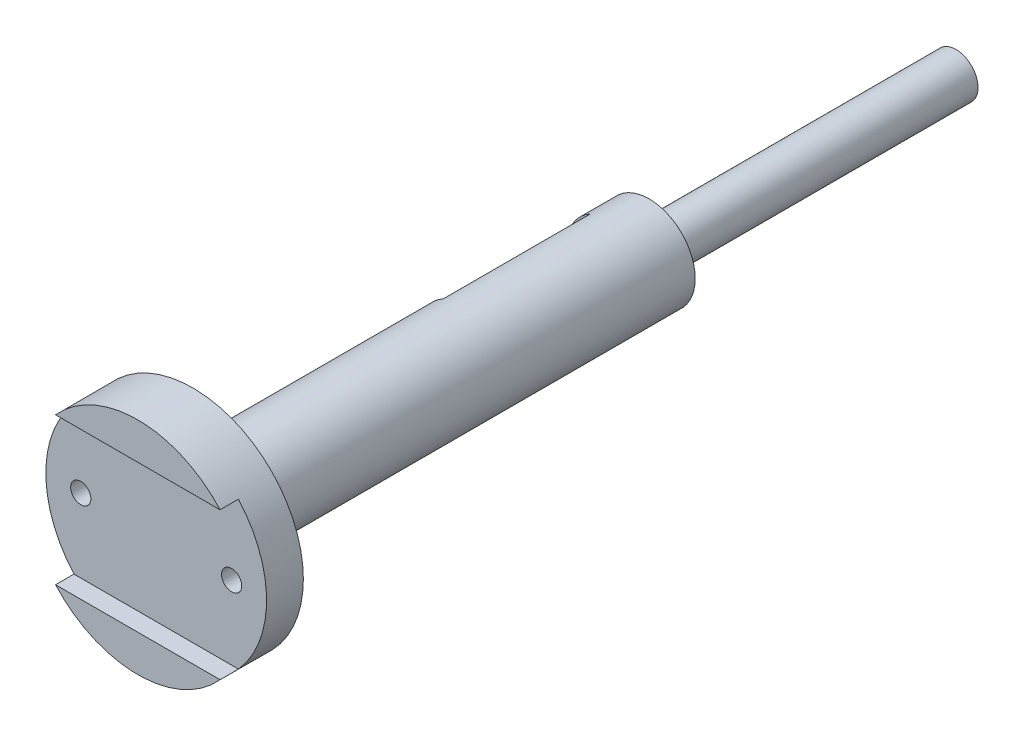
from build123d import *

# Parameters (mm, degrees)
ESQUISSE1_R                                = 30
BOSS_EXTRU_1_DEPTH                         = 15
ESQUISSE2_R                                = 12.5
BOSS_EXTRU_2_DEPTH                         = 124
ESQUISSE4_2_W                              = 230
ESQUISSE4_2_H                              = 40
ENL_V_MAT_EXTRU_1_DEPTH                    = 5
CHAMBRAGE_POUR_VIS_T_TE_HEXAGONALE_2_COUNT = 2
CHAMBRAGE_POUR_VIS_T_TE_HEXAGONALE_2_PITCH = 41
ESQUISSE17_R                               = 6
BOSS_EXTRU_4_DEPTH                         = 83.38
ESQUISSE18_W                               = 10.356322474
ESQUISSE18_H                               = 3
ENL_V_MAT_EXTRU_2_DEPTH                    = 3
ESQUISSE19_W                               = 7.933443835
ESQUISSE19_H                               = 21.9317122
ENL_V_MAT_EXTRU_3_DEPTH                    = 50
BOSS_EXTRU_6_START                         = -10
ESQUISSE21_R                               = 12.5
BOSS_EXTRU_6_DEPTH                         = 10


with BuildPart() as part:
    # Esquisse1 → Boss.-Extru.1 (new body)
    with BuildSketch(Plane.XY):
        Circle(ESQUISSE1_R)
    extrude(amount=BOSS_EXTRU_1_DEPTH)

    # Esquisse2 → Boss.-Extru.2 (add)
    with BuildSketch(Plane(origin=(0, 0, 0), x_dir=(-1, 0, 0), z_dir=(0, 0, -1))):
        Circle(ESQUISSE2_R)
    extrude(amount=BOSS_EXTRU_2_DEPTH)

    # Esquisse4<2> → Enlèv. mat.-Extru.1 (cut)
    with BuildSketch(Plane.XY.offset(15)):
        Rectangle(ESQUISSE4_2_W, ESQUISSE4_2_H)
    extrude(amount=-ENL_V_MAT_EXTRU_1_DEPTH, mode=Mode.SUBTRACT)

    # Esquisse14 → Chambrage pour vis à tête hexagonale M51 (revolve, cut)
    with BuildSketch(Plane.YZ.offset(-20.5)):
        Polygon((0, 0), (0, 15), (2.75, 15), (2.75, 3.605), (2.775, 3.58), (6.12, 3.58), (6.12, 0), align=None)
    chambrage_pour_vis_t_te_hexagonale_m51 = revolve(axis=Axis((-20.5, 0, -6.35), (0, 0, 1)), mode=Mode.SUBTRACT)

    # Chambrage pour vis _ t_te hexagonale 2: Chambrage pour vis à tête hexagonale M51 ×2
    with Locations(*[(i * CHAMBRAGE_POUR_VIS_T_TE_HEXAGONALE_2_PITCH, 0, 0) for i in range(1, CHAMBRAGE_POUR_VIS_T_TE_HEXAGONALE_2_COUNT)]):
        add(chambrage_pour_vis_t_te_hexagonale_m51, mode=Mode.SUBTRACT)

    # Esquisse17 → Boss.-Extru.4 (add)
    with BuildSketch(Plane(origin=(0, 0, -124), x_dir=(-1, 0, 0), z_dir=(0, 0, -1))):
        Circle(ESQUISSE17_R)
    extrude(amount=BOSS_EXTRU_4_DEPTH)

    # Esquisse18 → Enlèv. mat.-Extru.2 (cut)
    with BuildSketch(Plane(origin=(0, 0, -207.38), x_dir=(-1, 0, 0), z_dir=(0, 0, -1))):
        with Locations((1.787207702, 0)):
            Rectangle(ESQUISSE18_W, ESQUISSE18_H)
    extrude(amount=-ENL_V_MAT_EXTRU_2_DEPTH, mode=Mode.SUBTRACT)

    # Esquisse19 → Enlèv. mat.-Extru.3 (cut)
    with BuildSketch(Plane(origin=(0, 0, -124), x_dir=(-1, 0, 0), z_dir=(0, 0, -1))):
        with Locations((9.966721917, 0)):
            Rectangle(ESQUISSE19_W, ESQUISSE19_H)
    extrude(amount=-ENL_V_MAT_EXTRU_3_DEPTH, mode=Mode.SUBTRACT)

    # Esquisse21 → Boss.-Extru.6 (add)
    with BuildSketch(Plane(origin=(0, 0, -124), x_dir=(-1, 0, 0), z_dir=(0, 0, -1)).offset(BOSS_EXTRU_6_START)):
        Circle(ESQUISSE21_R)
    extrude(amount=BOSS_EXTRU_6_DEPTH)


solid = part.part
